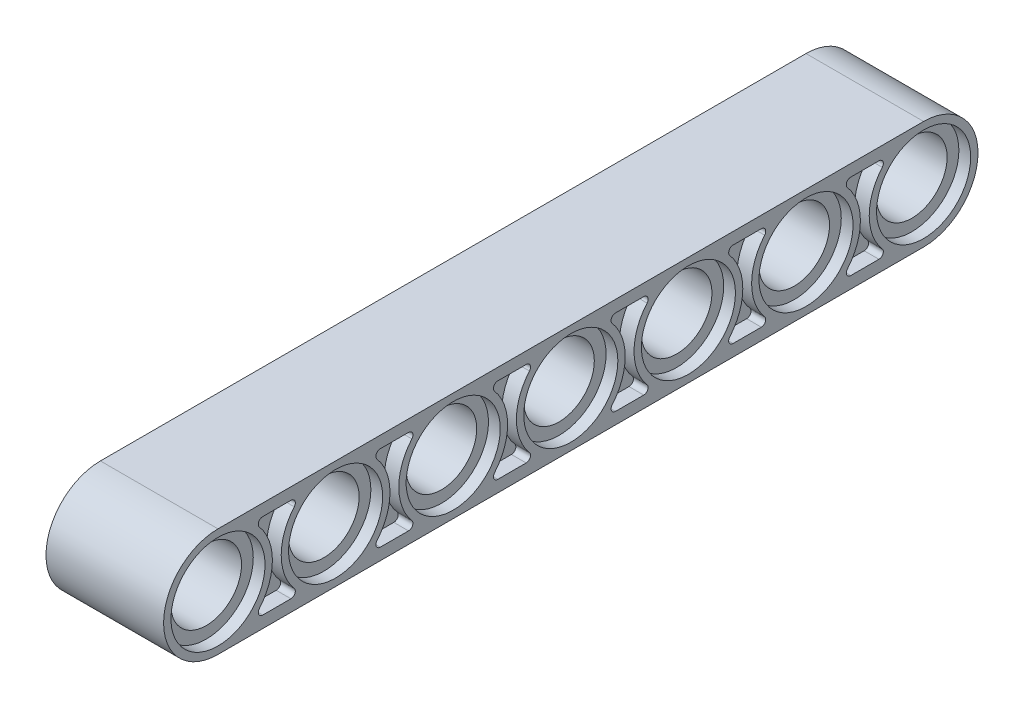
from build123d import *

# Parameters (mm, degrees)
SKETCH1_R           = 2.4
BOSS_EXTRUDE1_DEPTH = 8
SKETCH2_R           = 3.2
CUT_EXTRUDE1_DEPTH  = 0.8
CUT_EXTRUDE2_START  = -1
CUT_EXTRUDE2_DEPTH  = 1


with BuildPart() as part:
    # Sketch1 → Boss-Extrude1 (new body)
    with BuildSketch(Plane(origin=(0, 0, 0), x_dir=(0, 0, -1), z_dir=(1, 0, 0))):
        with BuildLine():
            Line((-10.64973545, 3.7), (37.35026455, 3.7))
            ThreePointArc((37.35026455, 3.7), (41.05026455, 0), (37.35026455, -3.7))
            Line((37.35026455, -3.7), (-10.64973545, -3.7))
            ThreePointArc((-10.64973545, -3.7), (-14.34973545, 0), (-10.64973545, 3.7))
        make_face()
        with Locations((-10.64973545, 0)):
            Circle(SKETCH1_R, mode=Mode.SUBTRACT)
        with Locations((-2.64973545, 0)):
            Circle(SKETCH1_R, mode=Mode.SUBTRACT)
        with Locations((5.35026455, 0)):
            Circle(SKETCH1_R, mode=Mode.SUBTRACT)
        with Locations((13.35026455, 0)):
            Circle(SKETCH1_R, mode=Mode.SUBTRACT)
        with Locations((21.35026455, 0)):
            Circle(SKETCH1_R, mode=Mode.SUBTRACT)
        with Locations((29.35026455, 0)):
            Circle(SKETCH1_R, mode=Mode.SUBTRACT)
        with Locations((37.35026455, 0)):
            Circle(SKETCH1_R, mode=Mode.SUBTRACT)
    extrude(amount=BOSS_EXTRUDE1_DEPTH)

    # Sketch2 → Cut-Extrude1 (cut)
    with BuildSketch(Plane(origin=(8, 0, 0), x_dir=(0, 0, -1), z_dir=(1, 0, 0))):
        with Locations((-10.64973545, 0)):
            Circle(SKETCH2_R)
        with Locations((-2.64973545, 0)):
            Circle(SKETCH2_R)
        with Locations((5.35026455, 0)):
            Circle(SKETCH2_R)
        with Locations((13.35026455, 0)):
            Circle(SKETCH2_R)
        with Locations((21.35026455, 0)):
            Circle(SKETCH2_R)
        with Locations((29.35026455, 0)):
            Circle(SKETCH2_R)
        with Locations((37.35026455, 0)):
            Circle(SKETCH2_R)
    cut_extrude1 = extrude(amount=-CUT_EXTRUDE1_DEPTH, mode=Mode.SUBTRACT)

    # Sketch3 → Cut-Extrude2 (cut)
    with BuildSketch(Plane(origin=(8, 0, 0), x_dir=(0, 0, -1), z_dir=(1, 0, 0)).offset(CUT_EXTRUDE2_START)):
        with BuildLine():
            Line((-7.609998619, 2.9), (-5.68947228, 2.9))
            ThreePointArc((-5.68947228, 2.9), (-5.416983749, 2.725499004), (-5.461492018, 2.405))
            ThreePointArc((-5.461492018, 2.405), (-6.34973545, 0), (-5.461492018, -2.405))
            ThreePointArc((-5.461492018, -2.405), (-5.416983749, -2.725499004), (-5.68947228, -2.9))
            Line((-5.68947228, -2.9), (-7.609998619, -2.9))
            ThreePointArc((-7.609998619, -2.9), (-7.882487151, -2.725499004), (-7.837978881, -2.405))
            ThreePointArc((-7.837978881, -2.405), (-6.94973545, 0), (-7.837978881, 2.405))
            ThreePointArc((-7.837978881, 2.405), (-7.882487151, 2.725499004), (-7.609998619, 2.9))
        make_face()
        with BuildLine():
            Line((0.390001381, 2.9), (2.31052772, 2.9))
            ThreePointArc((2.31052772, 2.9), (2.583016251, 2.725499004), (2.538507982, 2.405))
            ThreePointArc((2.538507982, 2.405), (1.65026455, 0), (2.538507982, -2.405))
            ThreePointArc((2.538507982, -2.405), (2.583016251, -2.725499004), (2.31052772, -2.9))
            Line((2.31052772, -2.9), (0.390001381, -2.9))
            ThreePointArc((0.390001381, -2.9), (0.117512849, -2.725499004), (0.162021119, -2.405))
            ThreePointArc((0.162021119, -2.405), (1.05026455, 0), (0.162021119, 2.405))
            ThreePointArc((0.162021119, 2.405), (0.117512849, 2.725499004), (0.390001381, 2.9))
        make_face()
        with BuildLine():
            Line((8.390001381, 2.9), (10.31052772, 2.9))
            ThreePointArc((10.31052772, 2.9), (10.583016251, 2.725499004), (10.538507982, 2.405))
            ThreePointArc((10.538507982, 2.405), (9.65026455, 0), (10.538507982, -2.405))
            ThreePointArc((10.538507982, -2.405), (10.583016251, -2.725499004), (10.31052772, -2.9))
            Line((10.31052772, -2.9), (8.390001381, -2.9))
            ThreePointArc((8.390001381, -2.9), (8.117512849, -2.725499004), (8.162021119, -2.405))
            ThreePointArc((8.162021119, -2.405), (9.05026455, 0), (8.162021119, 2.405))
            ThreePointArc((8.162021119, 2.405), (8.117512849, 2.725499004), (8.390001381, 2.9))
        make_face()
        with BuildLine():
            Line((16.390001381, 2.9), (18.31052772, 2.9))
            ThreePointArc((18.31052772, 2.9), (18.583016251, 2.725499004), (18.538507982, 2.405))
            ThreePointArc((18.538507982, 2.405), (17.65026455, 0), (18.538507982, -2.405))
            ThreePointArc((18.538507982, -2.405), (18.583016251, -2.725499004), (18.31052772, -2.9))
            Line((18.31052772, -2.9), (16.390001381, -2.9))
            ThreePointArc((16.390001381, -2.9), (16.117512849, -2.725499004), (16.162021119, -2.405))
            ThreePointArc((16.162021119, -2.405), (17.05026455, 0), (16.162021119, 2.405))
            ThreePointArc((16.162021119, 2.405), (16.117512849, 2.725499004), (16.390001381, 2.9))
        make_face()
        with BuildLine():
            Line((24.390001381, 2.9), (26.31052772, 2.9))
            ThreePointArc((26.31052772, 2.9), (26.583016251, 2.725499004), (26.538507982, 2.405))
            ThreePointArc((26.538507982, 2.405), (25.65026455, 0), (26.538507982, -2.405))
            ThreePointArc((26.538507982, -2.405), (26.583016251, -2.725499004), (26.31052772, -2.9))
            Line((26.31052772, -2.9), (24.390001381, -2.9))
            ThreePointArc((24.390001381, -2.9), (24.117512849, -2.725499004), (24.162021119, -2.405))
            ThreePointArc((24.162021119, -2.405), (25.05026455, 0), (24.162021119, 2.405))
            ThreePointArc((24.162021119, 2.405), (24.117512849, 2.725499004), (24.390001381, 2.9))
        make_face()
        with BuildLine():
            Line((32.390001381, 2.9), (34.31052772, 2.9))
            ThreePointArc((34.31052772, 2.9), (34.583016251, 2.725499004), (34.538507982, 2.405))
            ThreePointArc((34.538507982, 2.405), (33.65026455, 0), (34.538507982, -2.405))
            ThreePointArc((34.538507982, -2.405), (34.583016251, -2.725499004), (34.31052772, -2.9))
            Line((34.31052772, -2.9), (32.390001381, -2.9))
            ThreePointArc((32.390001381, -2.9), (32.117512849, -2.725499004), (32.162021119, -2.405))
            ThreePointArc((32.162021119, -2.405), (33.05026455, 0), (32.162021119, 2.405))
            ThreePointArc((32.162021119, 2.405), (32.117512849, 2.725499004), (32.390001381, 2.9))
        make_face()
    cut_extrude2 = extrude(amount=CUT_EXTRUDE2_DEPTH, mode=Mode.SUBTRACT)

    # Mirror1: Cut-Extrude1, Cut-Extrude2 across plane
    add(cut_extrude1.mirror(Plane(origin=(4, 0, 0), x_dir=(0, 0, 1), z_dir=(1, 0, 0))), mode=Mode.SUBTRACT)
    add(cut_extrude2.mirror(Plane(origin=(4, 0, 0), x_dir=(0, 0, 1), z_dir=(1, 0, 0))), mode=Mode.SUBTRACT)


solid = part.part
